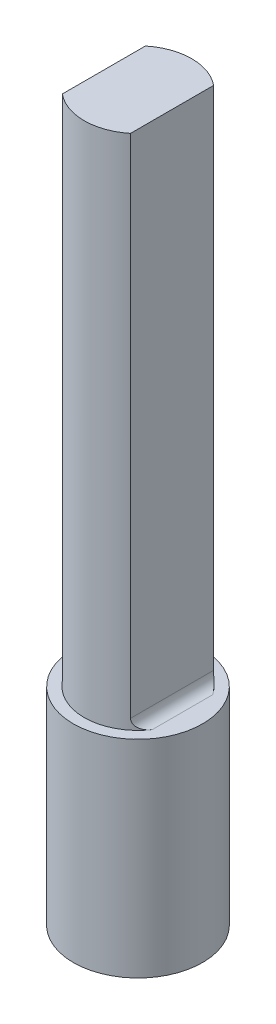
from build123d import *

# Parameters (mm, degrees)
SKETCH1_R           = 3.125
BOSS_EXTRUDE1_DEPTH = 5
BOSS_EXTRUDE2_DEPTH = 25
FILLET1_R           = 0.5


with BuildPart() as part:
    # Sketch1 → Boss-Extrude1 (new, symmetric)
    with BuildSketch(Plane(origin=(0, 0, 0), x_dir=(1, 0, 0), z_dir=(0, 1, 0))):
        with Locations(Location((0, 0, 0), (0, 0, 270))):
            Circle(SKETCH1_R)
    extrude(amount=BOSS_EXTRUDE1_DEPTH, both=True)

    # Sketch2 → Boss-Extrude2 (add)
    with BuildSketch(Plane(origin=(0, 5, 0), x_dir=(1, 0, 0), z_dir=(0, 1, 0))):
        with BuildLine():
            Line((-1.65, -2.00935313), (-1.65, 2.00935313))
            ThreePointArc((-1.65, 2.00935313), (0, 2.6), (1.65, 2.00935313))
            Line((1.65, 2.00935313), (1.65, -2.00935313))
            ThreePointArc((1.65, -2.00935313), (0, -2.6), (-1.65, -2.00935313))
        make_face()
    extrude(amount=BOSS_EXTRUDE2_DEPTH)

    # Fillet1
    fillet1_edges = [part.edges().sort_by_distance(p)[0] for p in [
        (1.65, 5, 0),
        (-1.65, 5, 0),
    ]]
    fillet(fillet1_edges, radius=FILLET1_R)


solid = part.part
